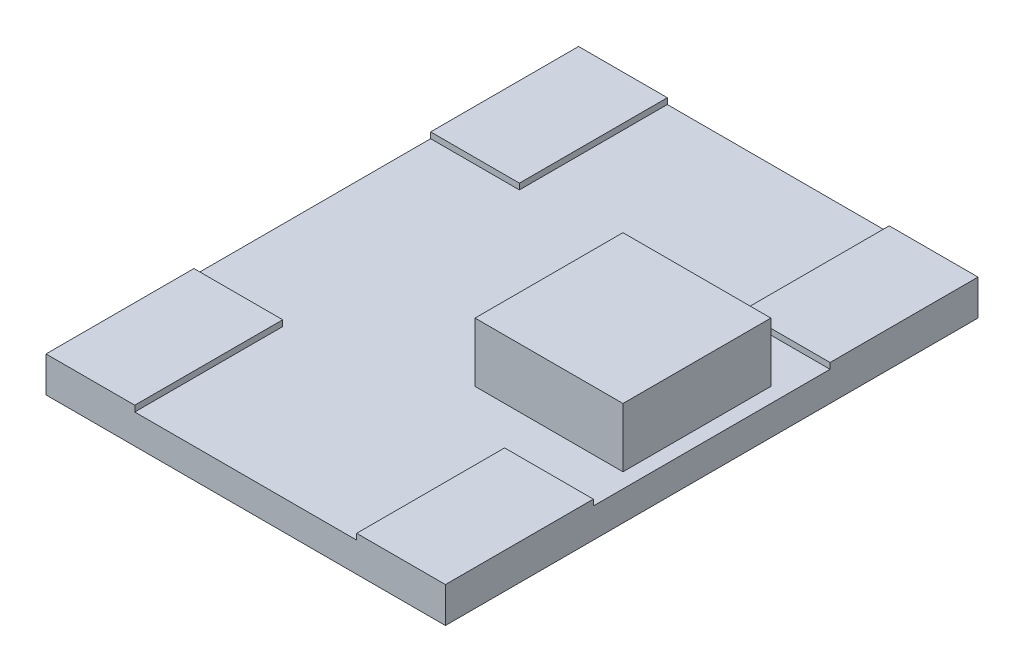
from build123d import *

# Parameters (mm, degrees)
SKETCH_1_W      = 13.5
SKETCH_1_H      = 18
EXTRUDE_1_DEPTH = 1
SKETCH_2_W      = 3
SKETCH_2_H      = 5
EXTRUDE_2_DEPTH = 0.2
SKETCH_3_W      = 5
SKETCH_3_H      = 5
EXTRUDE_3_DEPTH = 2


with BuildPart() as part:
    # Эскиз1 → Бобышка-Вытянуть1 (new body)
    with BuildSketch(Plane(origin=(0, 0, 0), x_dir=(1, 0, 0), z_dir=(0, 1, 0))):
        Rectangle(SKETCH_1_W, SKETCH_1_H)
    extrude(amount=EXTRUDE_1_DEPTH)

    # Эскиз2 → Бобышка-Вытянуть2 (add)
    with BuildSketch(Plane(origin=(0, 1, 0), x_dir=(1, 0, 0), z_dir=(0, 1, 0))):
        with Locations((-5.25, -6.5)):
            Rectangle(SKETCH_2_W, SKETCH_2_H)
        with Locations((5.25, -6.5)):
            Rectangle(SKETCH_2_W, SKETCH_2_H)
        with Locations((-5.25, 6.5)):
            Rectangle(SKETCH_2_W, SKETCH_2_H)
        with Locations((5.25, 6.5)):
            Rectangle(SKETCH_2_W, SKETCH_2_H)
    extrude(amount=EXTRUDE_2_DEPTH)

    # Эскиз3 → Бобышка-Вытянуть3 (add)
    with BuildSketch(Plane(origin=(0, 1, 0), x_dir=(1, 0, 0), z_dir=(0, 1, 0))):
        with Locations((3.75, 0)):
            Rectangle(SKETCH_3_W, SKETCH_3_H)
    extrude(amount=EXTRUDE_3_DEPTH)


solid = part.part
